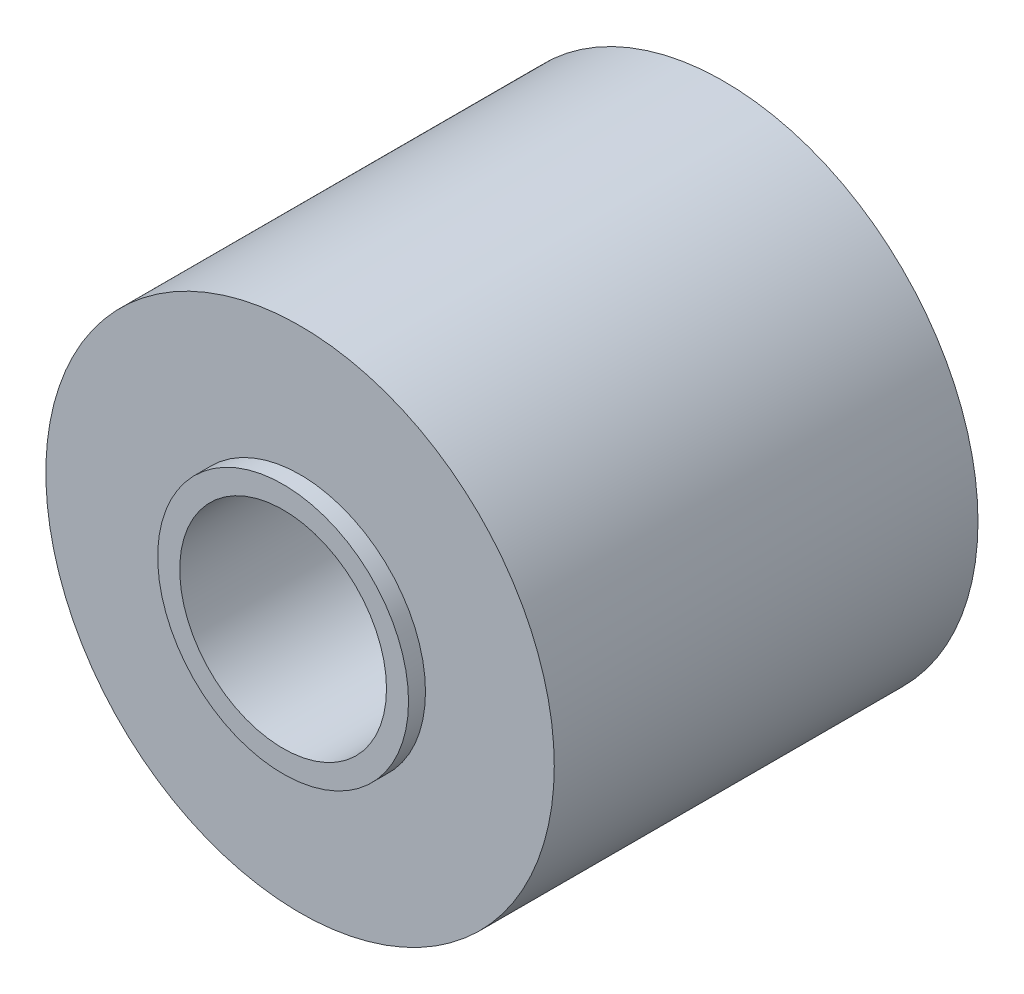
from build123d import *

# Parameters (mm, degrees)
SKETCH1_R           = 7.5
SKETCH1_R_2         = 3.05
BOSS_EXTRUDE1_DEPTH = 12.5
SKETCH2_R           = 3.7
SKETCH2_R_2         = 3.05
BOSS_EXTRUDE2_DEPTH = 0.5


with BuildPart() as part:
    # Sketch1 → Boss-Extrude1 (new body)
    with BuildSketch(Plane.XY):
        Circle(SKETCH1_R)
        Circle(SKETCH1_R_2, mode=Mode.SUBTRACT)
    extrude(amount=BOSS_EXTRUDE1_DEPTH)

    # Sketch2 → Boss-Extrude2 (add)
    with BuildSketch(Plane.XY.offset(12.5)):
        Circle(SKETCH2_R)
        Circle(SKETCH2_R_2, mode=Mode.SUBTRACT)
    extrude(amount=BOSS_EXTRUDE2_DEPTH)


solid = part.part
